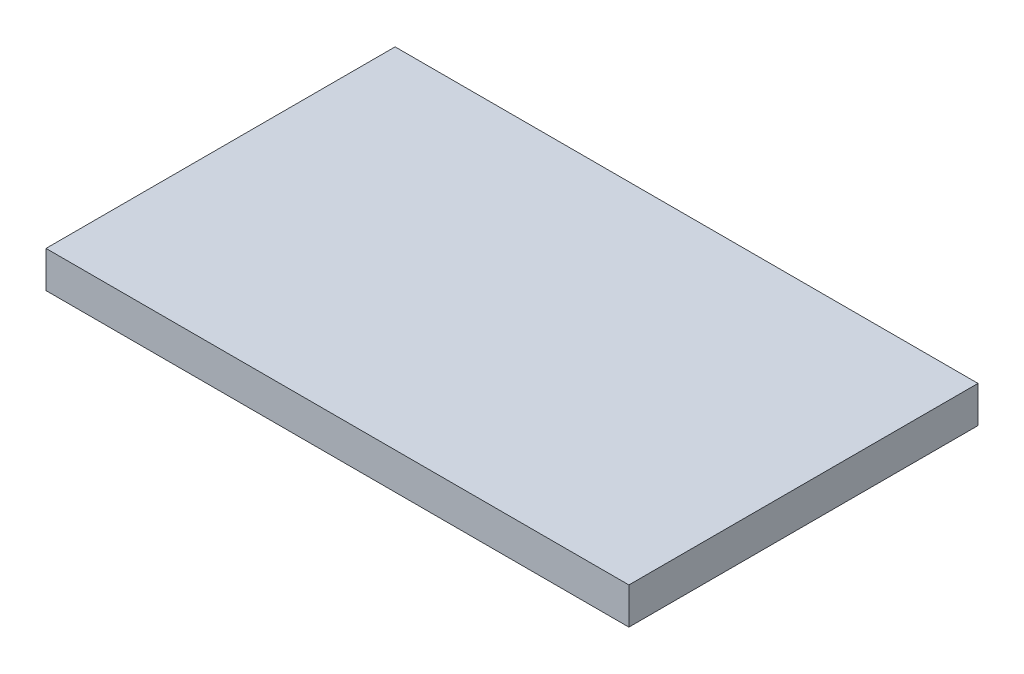
from build123d import *

# Parameters (mm, degrees)
SKETCH1_W           = 40.493891915
SKETCH1_H           = 24.251425102
BOSS_EXTRUDE1_DEPTH = 2.54


with BuildPart() as part:
    # Sketch1 → Boss-Extrude1 (new body)
    with BuildSketch(Plane(origin=(0, 0, 0), x_dir=(1, 0, 0), z_dir=(0, 1, 0))):
        with Locations((20.246945958, 12.125712551)):
            Rectangle(SKETCH1_W, SKETCH1_H)
    extrude(amount=BOSS_EXTRUDE1_DEPTH)


solid = part.part
